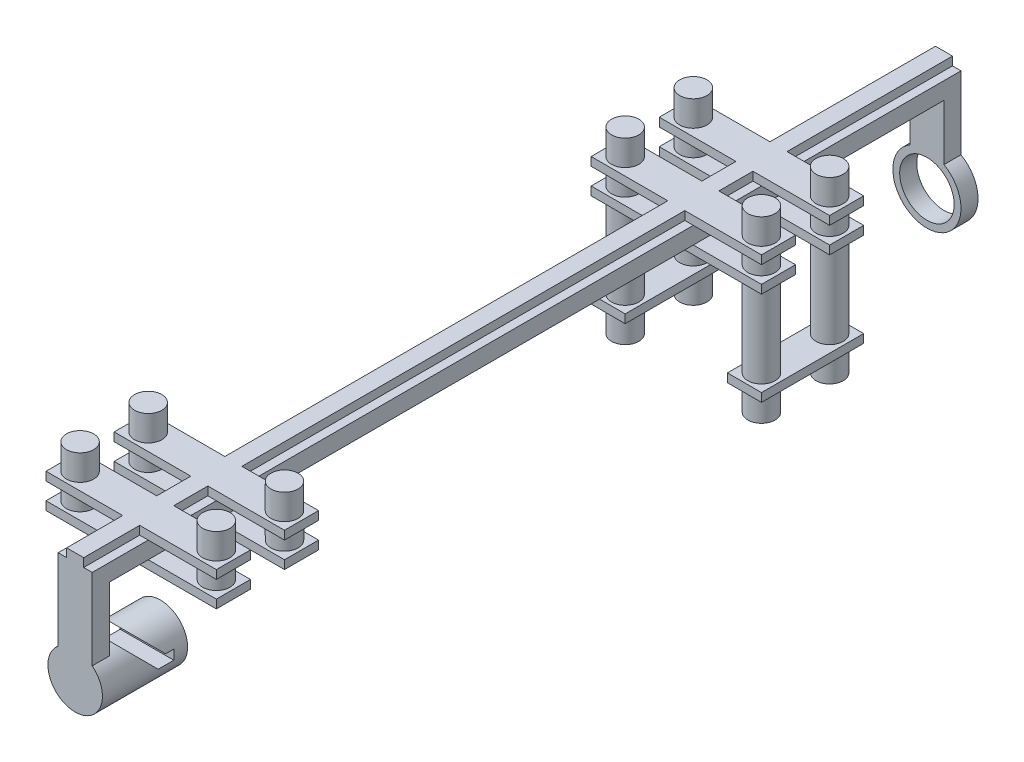
from build123d import *

# Parameters (mm, degrees)
SKETCH1_R                 = 10
SKETCH1_R_2               = 8
BOSS_EXTRUDE1_DEPTH       = 5
SKETCH2_W                 = 10
SKETCH2_H                 = 5
BOSS_EXTRUDE2_DEPTH       = 250
BOSS_EXTRUDE3_START       = -5
BOSS_EXTRUDE3_DEPTH       = 5
BOSS_EXTRUDE4_START       = 20
SKETCH5_R                 = 8
BOSS_EXTRUDE4_DEPTH       = 20
CUT_EXTRUDE1_DEPTH        = 257.953303151
CUT_EXTRUDE1_DEPTH_BACK   = 257.953303151
BOSS_EXTRUDE5_START       = -2.5
SKETCH7_W                 = 5
SKETCH7_H                 = 255
BOSS_EXTRUDE5_DEPTH       = 5
SKETCH9_W                 = 50
SKETCH9_H                 = 10
BOSS_EXTRUDE6_DEPTH       = 2.5
BOSS_EXTRUDE7_START       = -5
SKETCH9_2_W               = 50
SKETCH9_2_H               = 10
BOSS_EXTRUDE7_DEPTH       = 2.5
SKETCH10_R                = 4
BOSS_EXTRUDE8_DEPTH       = 15
LPATTERN1_COUNT           = 2
LPATTERN1_PITCH           = 160
LPATTERN2_COUNT           = 2
LPATTERN2_PITCH           = 20
LPATTERN3_COPY_1_SKETCH_W = 50
LPATTERN3_COPY_1_SKETCH_H = 10
LPATTERN3_COPY_1_DEPTH    = 2.5
LPATTERN3_START           = -5
LPATTERN3_COPY_2_SKETCH_W = 50
LPATTERN3_COPY_2_SKETCH_H = 10
LPATTERN3_COPY_2_DEPTH    = 2.5
LPATTERN3_COPY_3_SKETCH_R = 4
LPATTERN3_COPY_3_DEPTH    = 15
LPATTERN3_COPY_4_SKETCH_W = 50
LPATTERN3_COPY_4_SKETCH_H = 10
LPATTERN3_COPY_4_DEPTH    = 2.5
LPATTERN3_COPY_5_SKETCH_W = 50
LPATTERN3_COPY_5_SKETCH_H = 10
LPATTERN3_COPY_5_DEPTH    = 2.5
LPATTERN3_COPY_6_SKETCH_R = 4
LPATTERN3_COPY_6_DEPTH    = 15
BOSS_EXTRUDE9_START       = 25
SKETCH11_R                = 4
BOSS_EXTRUDE9_DEPTH       = 25
SKETCH12_W                = 10
SKETCH12_H                = 30
BOSS_EXTRUDE10_DEPTH      = 2.5
BOSS_EXTRUDE11_START      = 35
SKETCH11_2_R              = 4
BOSS_EXTRUDE11_DEPTH      = 7.5


with BuildPart() as part:
    # Sketch1 → Boss-Extrude1 (new body)
    # profile 1 of 3: a face of its own
    with BuildSketch(Plane.XY):
        Circle(SKETCH1_R)
        Circle(SKETCH1_R_2, mode=Mode.SUBTRACT)
    # profile 2 of 3: a face of its own
    with BuildSketch(Plane.XY):
        with BuildLine():
            ThreePointArc((-5, 8.660254038), (-2.588190451, 9.659258263), (0, 10))
            Line((0, 10), (0, 30))
            Line((0, 30), (-5, 30))
            Line((-5, 30), (-5, 8.660254038))
        make_face()
    # profile 3 of 3: a face of its own
    with BuildSketch(Plane.XY):
        with BuildLine():
            Line((0, 30), (0, 10))
            ThreePointArc((0, 10), (2.588190451, 9.659258263), (5, 8.660254038))
            Line((5, 8.660254038), (5, 30))
            Line((5, 30), (0, 30))
        make_face()
    extrude(amount=BOSS_EXTRUDE1_DEPTH)

    # Sketch2 → Boss-Extrude2 (add)
    with BuildSketch(Plane.XY.offset(5)):
        with Locations((0, 27.5)):
            Rectangle(SKETCH2_W, SKETCH2_H)
    extrude(amount=BOSS_EXTRUDE2_DEPTH)

    # Sketch4 → Boss-Extrude3 (add)
    with BuildSketch(Plane.XY.offset(255).offset(BOSS_EXTRUDE3_START)):
        with BuildLine():
            Line((-5, 25), (5, 25))
            Line((5, 25), (5, 6.244997998))
            ThreePointArc((5, 6.244997998), (0, -8), (-5, 6.244997998))
            Line((-5, 6.244997998), (-5, 25))
        make_face()
    extrude(amount=BOSS_EXTRUDE3_DEPTH)

    # Sketch5 → Boss-Extrude4 (add)
    with BuildSketch(Plane(origin=(0, 0, 250), x_dir=(-1, 0, 0), z_dir=(0, 0, -1)).offset(BOSS_EXTRUDE4_START)):
        with Locations(Location((0, 0, 0), (0, 0, 180))):
            Circle(SKETCH5_R)
    extrude(amount=-BOSS_EXTRUDE4_DEPTH)

    # Sketch6 → Cut-Extrude1 (cut, two sides: drawn at the far end of the back side and taken through both)
    with BuildSketch(Plane(origin=(0, 0, 0), x_dir=(0, 0, -1), z_dir=(1, 0, 0)).offset(-CUT_EXTRUDE1_DEPTH_BACK)):
        Polygon((-243.585291862, 8.659957716), (-248.585291862, 8.659957716), (-239.925334146, 0), (-238.509860061, -1.415474085), (-233.925334146, -1.415474085), (-233.925334146, 1.415474085), (-236.340808231, 1.415474085), align=None)
    extrude(amount=CUT_EXTRUDE1_DEPTH + CUT_EXTRUDE1_DEPTH_BACK, mode=Mode.SUBTRACT)

    # Sketch7 → Boss-Extrude5 (add, symmetric)
    with BuildSketch(Plane.XZ.offset(-25).offset(BOSS_EXTRUDE5_START)):
        with Locations((0, 127.5)):
            Rectangle(SKETCH7_W, SKETCH7_H)
    extrude(amount=BOSS_EXTRUDE5_DEPTH, both=True)

    # Sketch9 → Boss-Extrude6 (add)
    with BuildSketch(Plane(origin=(0, 30, 0), x_dir=(1, 0, 0), z_dir=(0, 1, 0))):
        with Locations((0, -73.565096755)):
            Rectangle(SKETCH9_W, SKETCH9_H)
    boss_extrude6 = extrude(amount=BOSS_EXTRUDE6_DEPTH)

    # Sketch9<2> → Boss-Extrude7 (add)
    with BuildSketch(Plane(origin=(0, 30, 0), x_dir=(1, 0, 0), z_dir=(0, 1, 0)).offset(BOSS_EXTRUDE7_START)):
        with Locations((0, -73.565096755)):
            Rectangle(SKETCH9_2_W, SKETCH9_2_H)
    boss_extrude7 = extrude(amount=-BOSS_EXTRUDE7_DEPTH)

    # Sketch10 → Boss-Extrude8 (add)
    with BuildSketch(Plane(origin=(0, 25, 0), x_dir=(1, 0, 0), z_dir=(0, 1, 0))):
        with Locations(Location((20, -73.565096755, 0), (0, 0, 180))):
            Circle(SKETCH10_R)
        with Locations(Location((-20, -73.565096755, 0), (0, 0, 180))):
            Circle(SKETCH10_R)
    boss_extrude8 = extrude(amount=BOSS_EXTRUDE8_DEPTH)

    # LPattern1: Boss-Extrude6, Boss-Extrude7, Boss-Extrude8 ×2
    with Locations(*[(0, 0, i * LPATTERN1_PITCH) for i in range(1, LPATTERN1_COUNT)]):
        add(boss_extrude6)
        add(boss_extrude7)
        add(boss_extrude8)

    # LPattern2: Boss-Extrude6, Boss-Extrude7, Boss-Extrude8 ×2
    with Locations(*[(0, 0, -i * LPATTERN2_PITCH) for i in range(1, LPATTERN2_COUNT)]):
        add(boss_extrude6)
        add(boss_extrude7)
        add(boss_extrude8)

    # LPattern3 copy 1 sketch → LPattern3 copy 1 (add)
    with BuildSketch(Plane(origin=(0, 30, 140), x_dir=(1, 0, 0), z_dir=(0, 1, 0))):
        with Locations((0, -73.565096755)):
            Rectangle(LPATTERN3_COPY_1_SKETCH_W, LPATTERN3_COPY_1_SKETCH_H)
    extrude(amount=LPATTERN3_COPY_1_DEPTH)

    # LPattern3 copy 2 sketch → LPattern3 copy 2 (add)
    with BuildSketch(Plane(origin=(0, 30, 140), x_dir=(1, 0, 0), z_dir=(0, 1, 0)).offset(LPATTERN3_START)):
        with Locations((0, -73.565096755)):
            Rectangle(LPATTERN3_COPY_2_SKETCH_W, LPATTERN3_COPY_2_SKETCH_H)
    extrude(amount=-LPATTERN3_COPY_2_DEPTH)

    # LPattern3 copy 3 sketch → LPattern3 copy 3 (add)
    with BuildSketch(Plane(origin=(0, 25, 140), x_dir=(1, 0, 0), z_dir=(0, 1, 0))):
        with Locations(Location((20, -73.565096755, 0), (0, 0, 180))):
            Circle(LPATTERN3_COPY_3_SKETCH_R)
        with Locations(Location((-20, -73.565096755, 0), (0, 0, 180))):
            Circle(LPATTERN3_COPY_3_SKETCH_R)
    extrude(amount=LPATTERN3_COPY_3_DEPTH)

    # LPattern3 copy 4 sketch → LPattern3 copy 4 (add)
    with BuildSketch(Plane(origin=(0, 30, -20), x_dir=(1, 0, 0), z_dir=(0, 1, 0))):
        with Locations((0, -73.565096755)):
            Rectangle(LPATTERN3_COPY_4_SKETCH_W, LPATTERN3_COPY_4_SKETCH_H)
    extrude(amount=LPATTERN3_COPY_4_DEPTH)

    # LPattern3 copy 5 sketch → LPattern3 copy 5 (add)
    with BuildSketch(Plane(origin=(0, 30, -20), x_dir=(1, 0, 0), z_dir=(0, 1, 0)).offset(LPATTERN3_START)):
        with Locations((0, -73.565096755)):
            Rectangle(LPATTERN3_COPY_5_SKETCH_W, LPATTERN3_COPY_5_SKETCH_H)
    extrude(amount=-LPATTERN3_COPY_5_DEPTH)

    # LPattern3 copy 6 sketch → LPattern3 copy 6 (add)
    with BuildSketch(Plane(origin=(0, 25, -20), x_dir=(1, 0, 0), z_dir=(0, 1, 0))):
        with Locations(Location((20, -73.565096755, 0), (0, 0, 180))):
            Circle(LPATTERN3_COPY_6_SKETCH_R)
        with Locations(Location((-20, -73.565096755, 0), (0, 0, 180))):
            Circle(LPATTERN3_COPY_6_SKETCH_R)
    extrude(amount=LPATTERN3_COPY_6_DEPTH)

    # Sketch11 → Boss-Extrude9 (add)
    with BuildSketch(Plane.XZ.offset(-22.5).offset(BOSS_EXTRUDE9_START)):
        with Locations(Location((-20, 73.565096755, 0), (0, 0, 180))):
            Circle(SKETCH11_R)
        with Locations(Location((20, 73.565096755, 0), (0, 0, 180))):
            Circle(SKETCH11_R)
        with Locations(Location((20, 53.565096755, 0), (0, 0, 180))):
            Circle(SKETCH11_R)
        with Locations(Location((-20, 53.565096755, 0), (0, 0, 180))):
            Circle(SKETCH11_R)
    extrude(amount=-BOSS_EXTRUDE9_DEPTH)

    # Sketch12 → Boss-Extrude10 (add)
    with BuildSketch(Plane.XZ.offset(2.5)):
        with Locations((20, 63.565096755)):
            Rectangle(SKETCH12_W, SKETCH12_H)
        with Locations((-20, 63.565096755)):
            Rectangle(SKETCH12_W, SKETCH12_H)
    extrude(amount=BOSS_EXTRUDE10_DEPTH)

    # Sketch11<2> → Boss-Extrude11 (add)
    with BuildSketch(Plane.XZ.offset(-22.5).offset(BOSS_EXTRUDE11_START)):
        with Locations(Location((-20, 73.565096755, 0), (0, 0, 180))):
            Circle(SKETCH11_2_R)
        with Locations(Location((20, 73.565096755, 0), (0, 0, 180))):
            Circle(SKETCH11_2_R)
        with Locations(Location((20, 53.565096755, 0), (0, 0, 180))):
            Circle(SKETCH11_2_R)
        with Locations(Location((-20, 53.565096755, 0), (0, 0, 180))):
            Circle(SKETCH11_2_R)
    extrude(amount=-BOSS_EXTRUDE11_DEPTH)


solid = part.part
